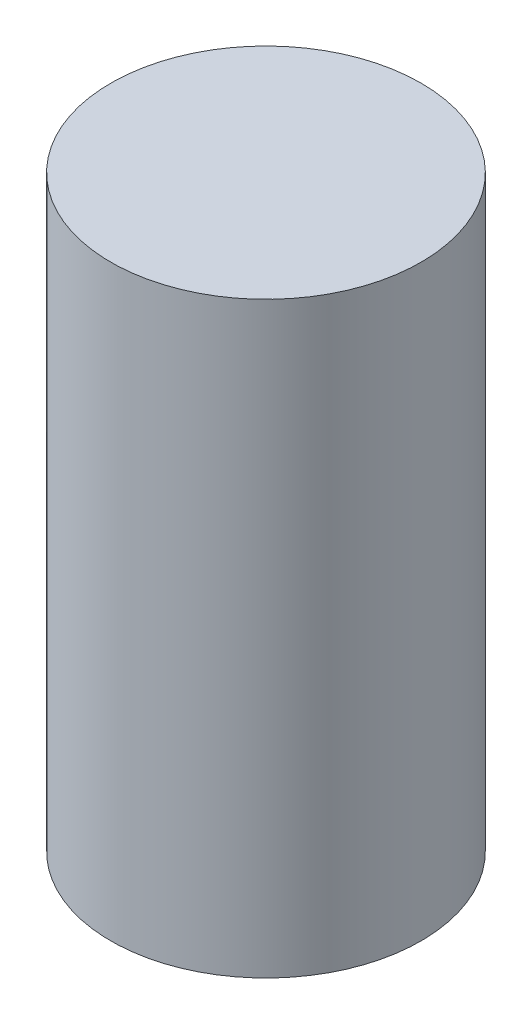
from build123d import *

# Parameters (mm, degrees)
SKETCH1_R           = 6.5024
BOSS_EXTRUDE1_DEPTH = 24.638


with BuildPart() as part:
    # Sketch1 → Boss-Extrude1 (new body)
    with BuildSketch(Plane(origin=(0, 0, 0), x_dir=(1, 0, 0), z_dir=(0, 1, 0))):
        with Locations(Location((0, 0, 0), (0, 0, 90))):
            Circle(SKETCH1_R)
    extrude(amount=BOSS_EXTRUDE1_DEPTH)


solid = part.part
